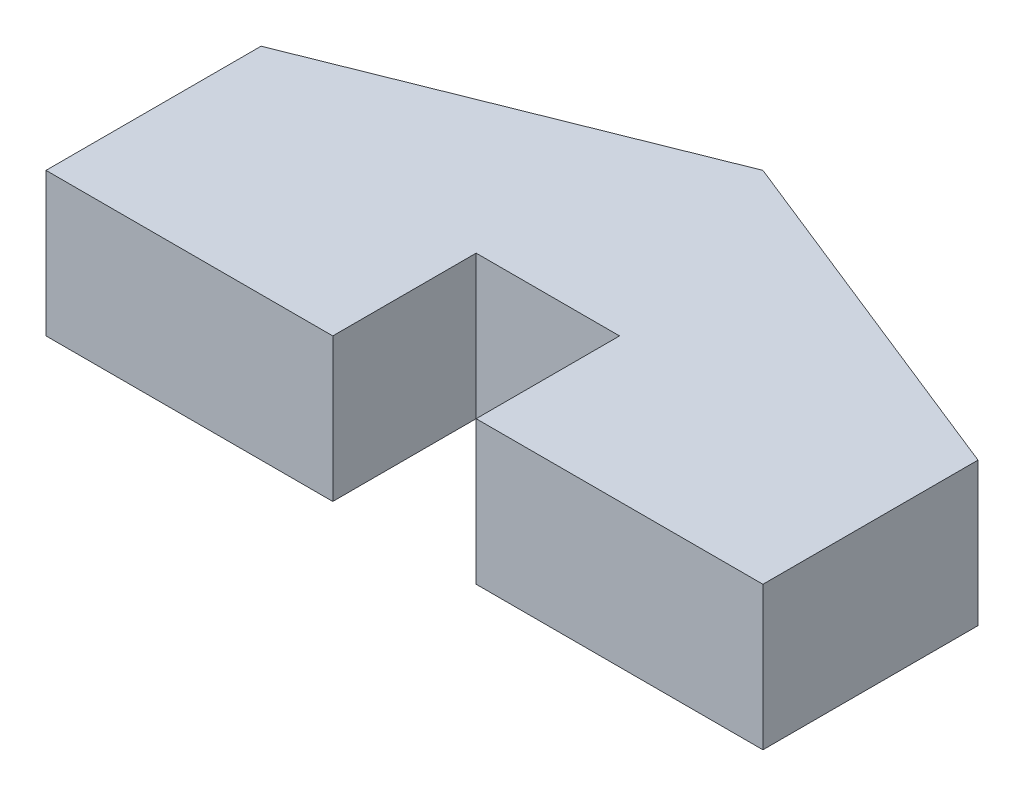
from build123d import *

# Parameters (mm, degrees)
BOSS_EXTRUDE1_DEPTH = 20


with BuildPart() as part:
    # Sketch1 → Boss-Extrude1 (new body)
    with BuildSketch(Plane(origin=(0, 0, 0), x_dir=(1, 0, 0), z_dir=(0, 1, 0))):
        Polygon((60, 0), (60, 20), (40, 20), (40, 0), (0, 0), (0, 30), (50, 50), (100, 30), (100, 0), align=None)
    extrude(amount=BOSS_EXTRUDE1_DEPTH)


solid = part.part
